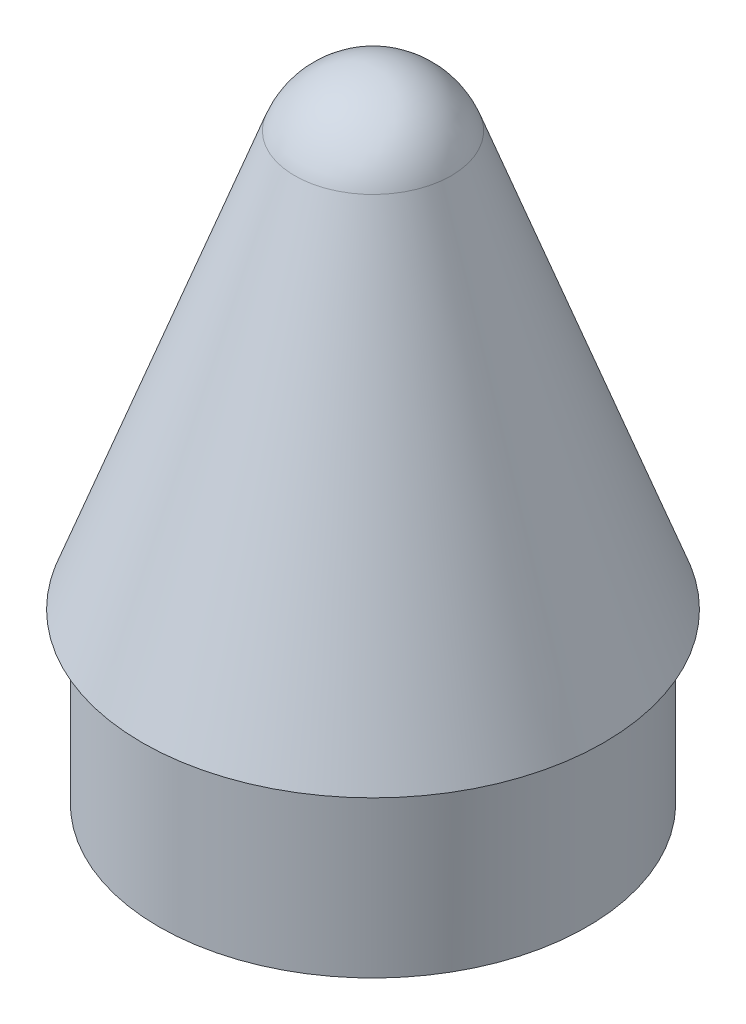
from build123d import *

# Parameters (mm, degrees)
SKETCH6_R           = 12.75
SKETCH6_R_2         = 2.5
BOSS_EXTRUDE2_DEPTH = 10


with BuildPart() as part:
    # Sketch5 → Revolve2 (revolve)
    with BuildSketch(Plane.XY, mode=Mode.PRIVATE) as revolve2_sk:
        with BuildLine():
            Line((0, 0), (-13.75, 0))
            Line((-13.75, 0), (-4.661495631, 24.7))
            ThreePointArc((-4.661495631, 24.7), (-2.841825215, 27.058541596), (0, 27.951821134))
            Line((0, 27.951821134), (0, 24.7))
            Line((0, 24.7), (0, 0))
        make_face()
    revolve(revolve2_sk.sketch.rotate(Axis((0, 0, 0), (0, 1, 0)), 270), axis=Axis((0, 0, 0), (0, 1, 0)))

    # Sketch6 → Boss-Extrude2 (add)
    with BuildSketch(Plane.XZ):
        with Locations(Location((0, 0, 0), (0, 0, 90))):
            Circle(SKETCH6_R)
        with Locations(Location((0, 0, 0), (0, 0, 270))):
            Circle(SKETCH6_R_2, mode=Mode.SUBTRACT)
    extrude(amount=BOSS_EXTRUDE2_DEPTH)


solid = part.part
